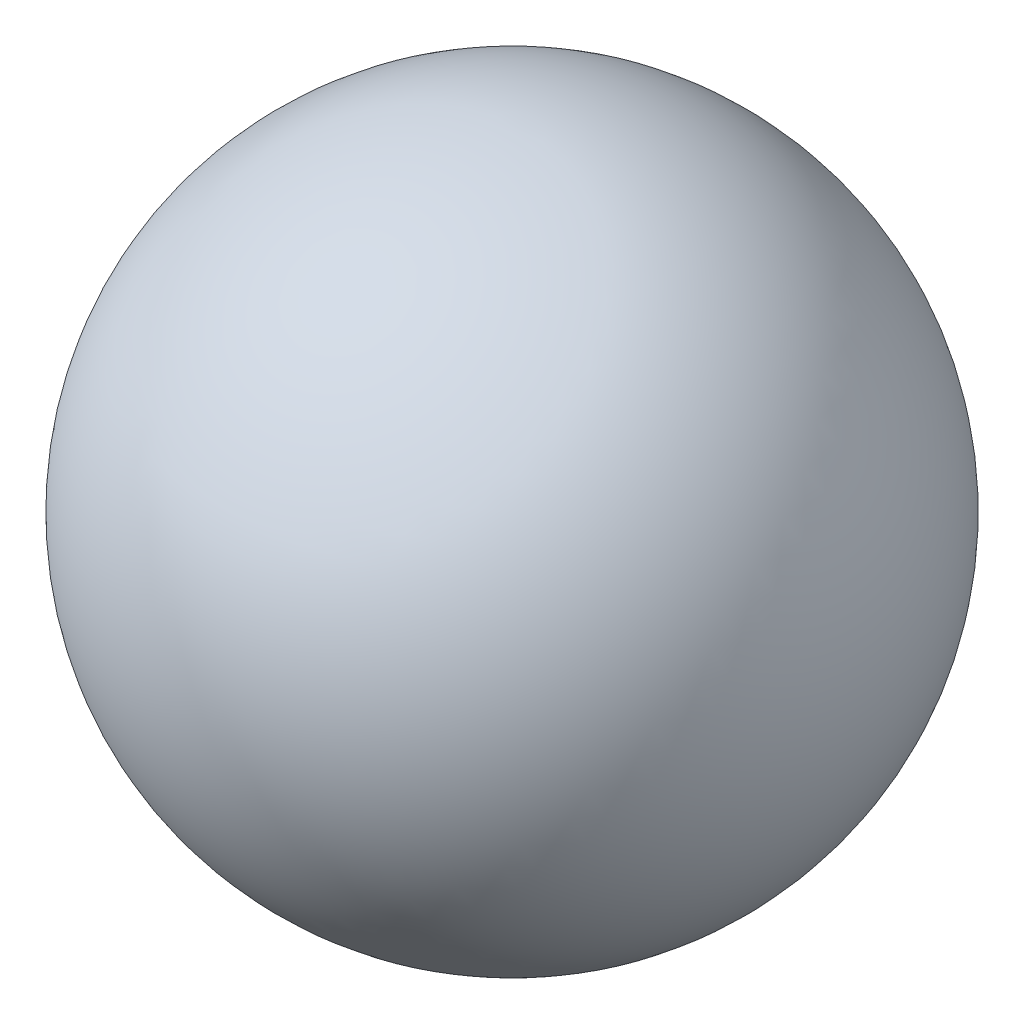
from build123d import *


with BuildPart() as part:
    # Esboço1 → Revolução1 (revolve)
    with BuildSketch(Plane.XY):
        with BuildLine():
            Line((0, 26.189053254), (0, -9.709112426))
            ThreePointArc((0, -9.709112426), (17.94908284, 8.239970414), (0, 26.189053254))
        make_face()
    revolve(axis=Axis((0, 47.906804734, 0), (0, -1, 0)))


solid = part.part
